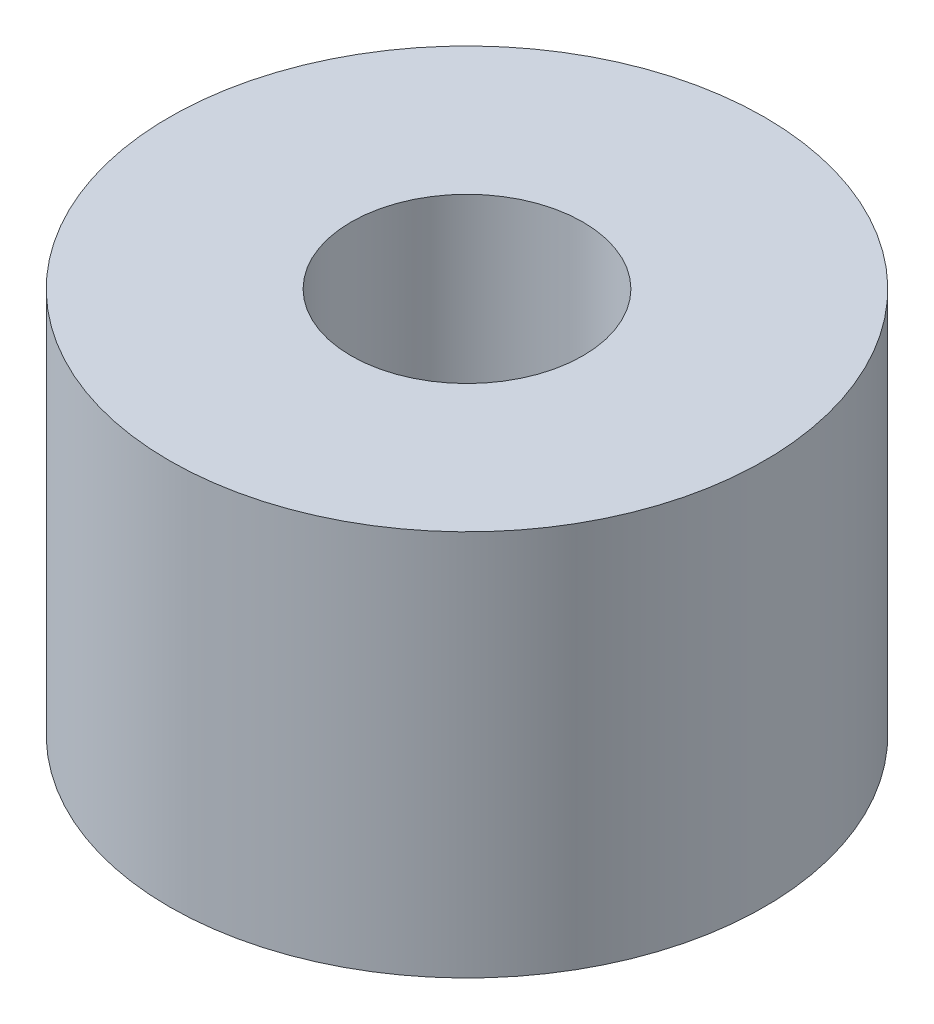
from build123d import *

# Parameters (mm, degrees)
SKETCH1_R           = 7.7
BOSS_EXTRUDE1_DEPTH = 10
SKETCH2_R           = 3
CUT_EXTRUDE1_DEPTH  = 5


with BuildPart() as part:
    # Sketch1 → Boss-Extrude1 (new body)
    with BuildSketch(Plane(origin=(0, 0, 0), x_dir=(1, 0, 0), z_dir=(0, 1, 0))):
        with Locations(Location((0, 0, 0), (0, 0, 270))):
            Circle(SKETCH1_R)
    extrude(amount=BOSS_EXTRUDE1_DEPTH)

    # Sketch2 → Cut-Extrude1 (cut)
    with BuildSketch(Plane(origin=(0, 10, 0), x_dir=(1, 0, 0), z_dir=(0, 1, 0))):
        with Locations(Location((0, 0, 0), (0, 0, 270))):
            Circle(SKETCH2_R)
    extrude(amount=-CUT_EXTRUDE1_DEPTH, mode=Mode.SUBTRACT)


solid = part.part
